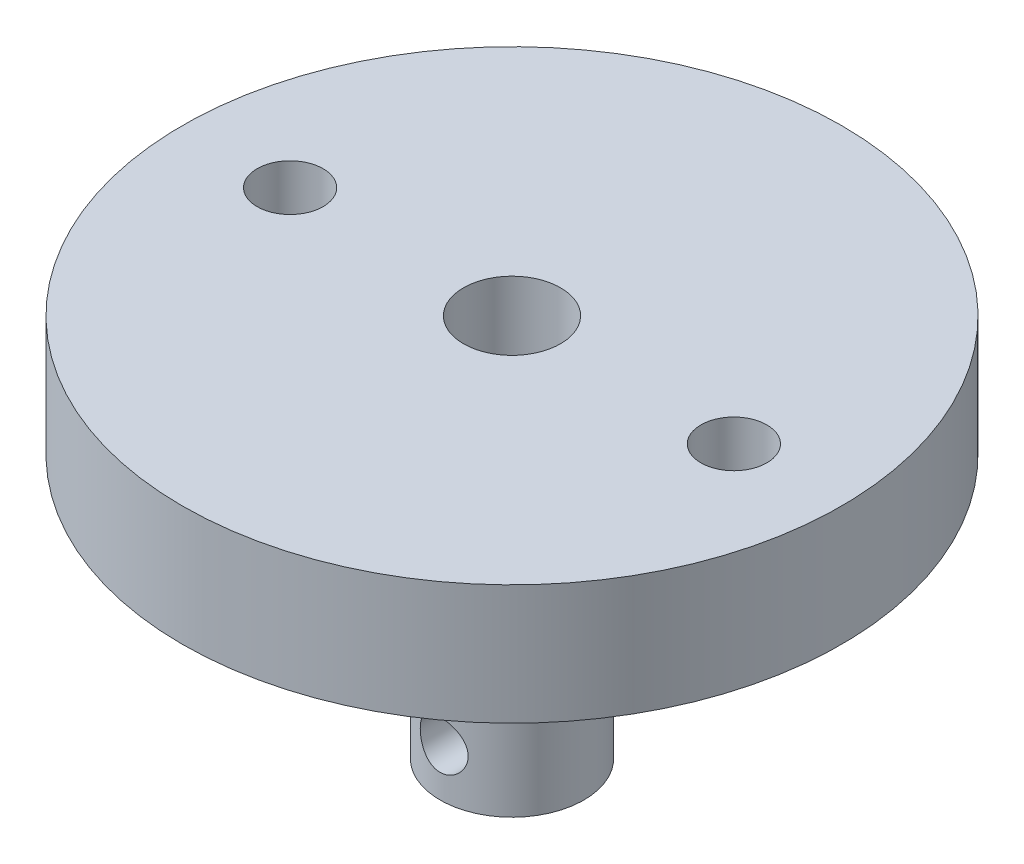
from build123d import *

# Parameters (mm, degrees)
SKETCH_1_R               = 27.5
EXTRUDE_1_DEPTH          = 10
SKETCH_2_R               = 2.75
CUT_EXTRUDE_1_DEPTH      = 10
PATTERN_CIRCULAR_1_COUNT = 2
SKETCH_3_R               = 6
EXTRUDE_2_DEPTH          = 22
SKETCH_5_R               = 3.15
CUT_EXTRUDE_3_DEPTH      = 12
SKETCH_4_R               = 4.05
CUT_EXTRUDE_2_DEPTH      = 15
CUT_EXTRUDE_4_DEPTH      = 45.682211225
CUT_EXTRUDE_4_DEPTH_BACK = 45.682211225
SKETCH_6_R               = 2


with BuildPart() as part:
    # 草图1 → 凸台-拉伸1 (new body)
    with BuildSketch(Plane(origin=(0, 0, 0), x_dir=(1, 0, 0), z_dir=(0, 1, 0))):
        with Locations(Location((0, 0, 0), (0, 0, 270))):
            Circle(SKETCH_1_R)
    extrude(amount=EXTRUDE_1_DEPTH)

    # 草图2 → 切除-拉伸1 (cut)
    with BuildSketch(Plane.XZ):
        with Locations(Location((18.515, 0, 0), (0, 0, 270))):
            Circle(SKETCH_2_R)
    cut_extrude_1 = extrude(amount=-CUT_EXTRUDE_1_DEPTH, mode=Mode.SUBTRACT)

    # 阵列(圆周)1: 切除-拉伸1 ×2 about axis
    pattern_circular_1_axis = Axis((0, 0, 0), (0, 1, 0))
    for i in range(1, PATTERN_CIRCULAR_1_COUNT):
        add(cut_extrude_1.rotate(pattern_circular_1_axis, i * 360 / PATTERN_CIRCULAR_1_COUNT), mode=Mode.SUBTRACT)

    # 草图3 → 凸台-拉伸2 (add)
    with BuildSketch(Plane.XZ):
        with Locations(Location((0, 0, 0), (0, 0, 270))):
            Circle(SKETCH_3_R)
    extrude(amount=EXTRUDE_2_DEPTH)

    # 草图5 → 切除-拉伸3 (cut)
    with BuildSketch(Plane.XZ.offset(22)):
        with Locations(Location((0, 0, 0), (0, 0, 270))):
            Circle(SKETCH_5_R)
    extrude(amount=-CUT_EXTRUDE_3_DEPTH, mode=Mode.SUBTRACT)

    # 草图4 → 切除-拉伸2 (cut)
    with BuildSketch(Plane(origin=(0, 10, 0), x_dir=(1, 0, 0), z_dir=(0, 1, 0))):
        with Locations(Location((0, 0, 0), (0, 0, 270))):
            Circle(SKETCH_4_R)
    extrude(amount=-CUT_EXTRUDE_2_DEPTH, mode=Mode.SUBTRACT)

    # 草图6 → 切除-拉伸4 (cut, two sides: drawn at the far end of the back side and taken through both)
    with BuildSketch(Plane.XY.offset(-CUT_EXTRUDE_4_DEPTH_BACK)):
        with Locations((0, -18)):
            Circle(SKETCH_6_R)
    extrude(amount=CUT_EXTRUDE_4_DEPTH + CUT_EXTRUDE_4_DEPTH_BACK, mode=Mode.SUBTRACT)


solid = part.part
